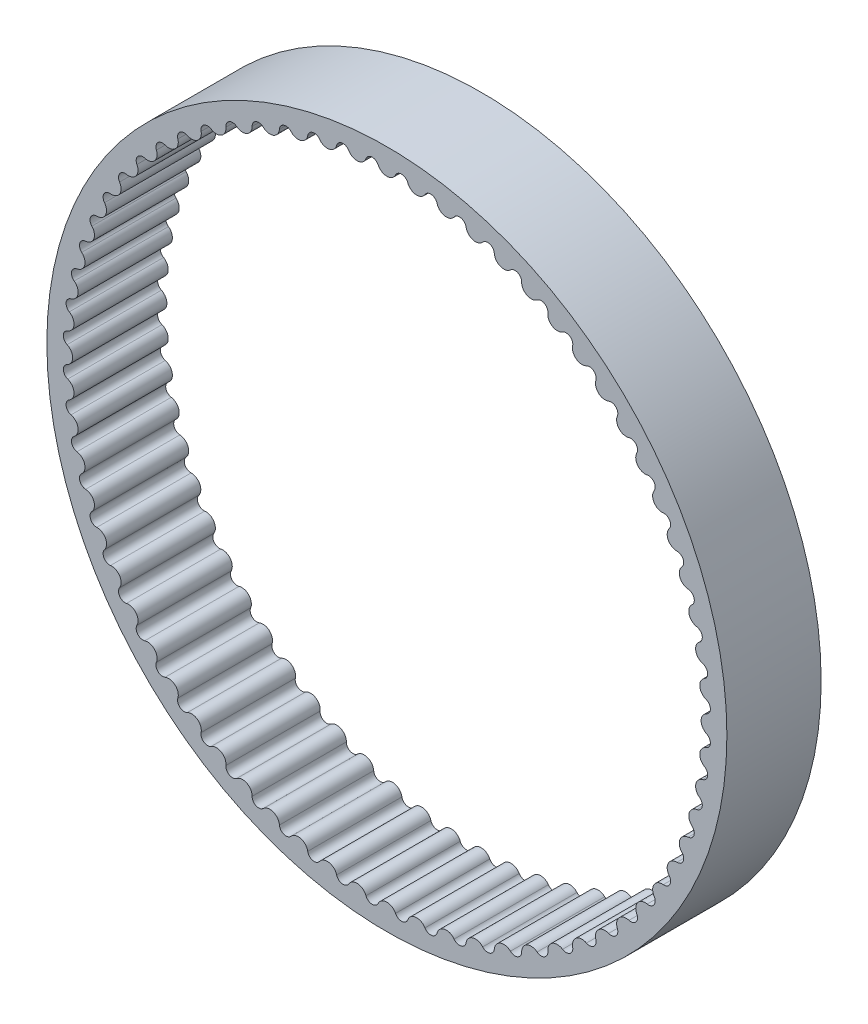
from build123d import *

# Parameters (mm, degrees)
SKETCH2_R           = 21.645090543
SKETCH2_R_2         = 20.005090543
BOSS_EXTRUDE1_DEPTH = 3
CUT_EXTRUDE1_DEPTH  = 31.757436325
CIRPATTERN3_COUNT   = 68


with BuildPart() as part:
    # Sketch2 → Boss-Extrude1 (new, symmetric)
    with BuildSketch(Plane.XY):
        Circle(SKETCH2_R)
        Circle(SKETCH2_R_2, mode=Mode.SUBTRACT)
    extrude(amount=BOSS_EXTRUDE1_DEPTH, both=True)

    # Sketch3 → Cut-Extrude1 (cut, symmetric)
    with BuildSketch(Plane.XY):
        with BuildLine():
            ThreePointArc((1.845836885, 19.919752354), (0.923904272, 19.983744608), (0, 20.005090543))
            ThreePointArc((0, 20.005090543), (0.325532217, 20.099213837), (0.550604878, 20.35253718))
            ThreePointArc((0.550604878, 20.35253718), (0.952076182, 20.593093722), (1.329639122, 20.316520254))
            ThreePointArc((1.329639122, 20.316520254), (1.530377933, 20.043510458), (1.845836885, 19.919752354))
        make_face()
    cut_extrude1 = extrude(amount=CUT_EXTRUDE1_DEPTH, both=True, mode=Mode.SUBTRACT)

    # CirPattern3: Cut-Extrude1 ×68 about axis
    cirpattern3_axis = Axis((0, 0, 3), (0, 0, -1))
    for i in range(1, CIRPATTERN3_COUNT):
        add(cut_extrude1.rotate(cirpattern3_axis, i * 360 / CIRPATTERN3_COUNT), mode=Mode.SUBTRACT)


solid = part.part
